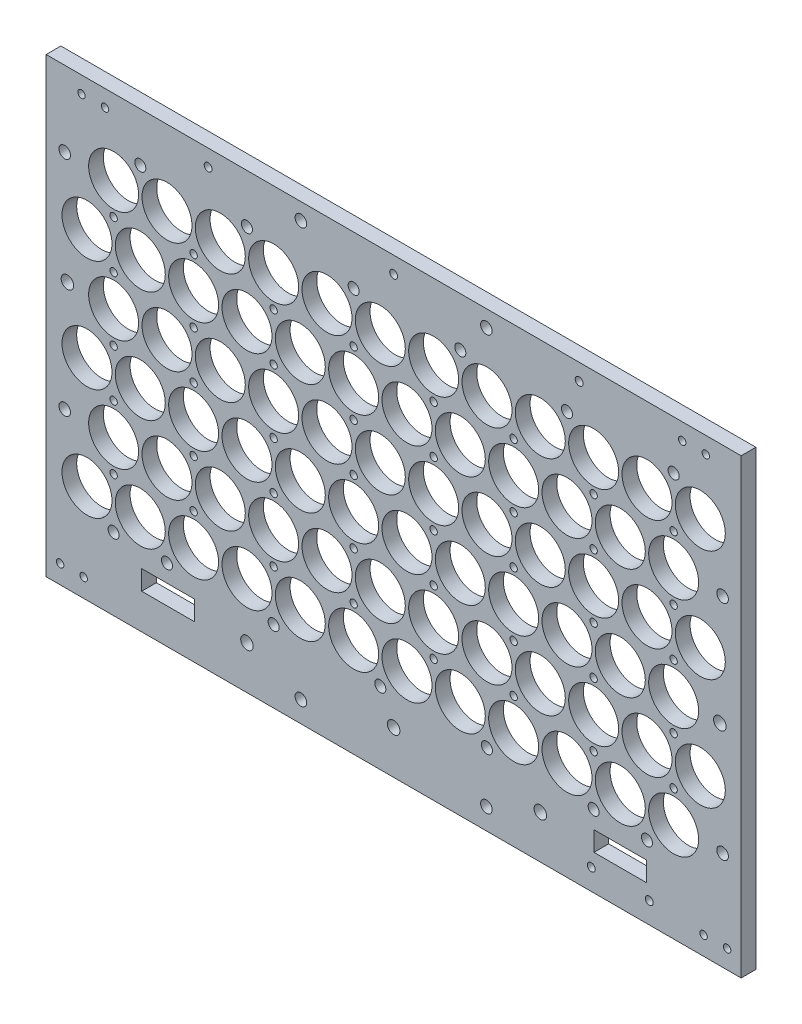
from build123d import *

# Parameters (mm, degrees)
SKETCH1_W                  = 299.700000132
SKETCH1_H                  = 194.250000104
BOSS_EXTRUDE1_DEPTH        = 6.35
SKETCH3_R                  = 10.775
CUT_EXTRUDE1_DEPTH         = 182.719853184
SKETCH4_R                  = 10.775
CUT_EXTRUDE2_DEPTH         = 182.719853184
LPATTERN1_COUNT            = 12
LPATTERN1_PITCH            = 23
LPATTERN2_COUNT            = 3
LPATTERN2_PITCH            = 48
LPATTERN2_COPY_1_SKETCH_R  = 10.775
LPATTERN2_COPY_1_DEPTH     = 182.719853184
LPATTERN2_COPY_2_SKETCH_R  = 10.775
LPATTERN2_COPY_2_DEPTH     = 182.719853184
LPATTERN2_COPY_3_SKETCH_R  = 10.775
LPATTERN2_COPY_3_DEPTH     = 182.719853184
LPATTERN2_COPY_4_SKETCH_R  = 10.775
LPATTERN2_COPY_4_DEPTH     = 182.719853184
LPATTERN2_COPY_5_SKETCH_R  = 10.775
LPATTERN2_COPY_5_DEPTH     = 182.719853184
LPATTERN2_COPY_6_SKETCH_R  = 10.775
LPATTERN2_COPY_6_DEPTH     = 182.719853184
LPATTERN2_COPY_7_SKETCH_R  = 10.775
LPATTERN2_COPY_7_DEPTH     = 182.719853184
LPATTERN2_COPY_8_SKETCH_R  = 10.775
LPATTERN2_COPY_8_DEPTH     = 182.719853184
LPATTERN2_COPY_9_SKETCH_R  = 10.775
LPATTERN2_COPY_9_DEPTH     = 182.719853184
LPATTERN2_COPY_10_SKETCH_R = 10.775
LPATTERN2_COPY_10_DEPTH    = 182.719853184
LPATTERN2_COPY_11_SKETCH_R = 10.775
LPATTERN2_COPY_11_DEPTH    = 182.719853184
LPATTERN2_COPY_12_SKETCH_R = 10.775
LPATTERN2_COPY_12_DEPTH    = 182.719853184
LPATTERN2_COPY_13_SKETCH_R = 10.775
LPATTERN2_COPY_13_DEPTH    = 182.719853184
LPATTERN2_COPY_14_SKETCH_R = 10.775
LPATTERN2_COPY_14_DEPTH    = 182.719853184
LPATTERN2_COPY_15_SKETCH_R = 10.775
LPATTERN2_COPY_15_DEPTH    = 182.719853184
LPATTERN2_COPY_16_SKETCH_R = 10.775
LPATTERN2_COPY_16_DEPTH    = 182.719853184
LPATTERN2_COPY_17_SKETCH_R = 10.775
LPATTERN2_COPY_17_DEPTH    = 182.719853184
LPATTERN2_COPY_18_SKETCH_R = 10.775
LPATTERN2_COPY_18_DEPTH    = 182.719853184
LPATTERN2_COPY_19_SKETCH_R = 10.775
LPATTERN2_COPY_19_DEPTH    = 182.719853184
LPATTERN2_COPY_20_SKETCH_R = 10.775
LPATTERN2_COPY_20_DEPTH    = 182.719853184
LPATTERN2_COPY_21_SKETCH_R = 10.775
LPATTERN2_COPY_21_DEPTH    = 182.719853184
LPATTERN2_COPY_22_SKETCH_R = 10.775
LPATTERN2_COPY_22_DEPTH    = 182.719853184
LPATTERN2_COPY_23_SKETCH_R = 10.775
LPATTERN2_COPY_23_DEPTH    = 182.719853184
LPATTERN2_COPY_24_SKETCH_R = 10.775
LPATTERN2_COPY_24_DEPTH    = 182.719853184
LPATTERN2_COPY_25_SKETCH_R = 10.775
LPATTERN2_COPY_25_DEPTH    = 182.719853184
LPATTERN2_COPY_26_SKETCH_R = 10.775
LPATTERN2_COPY_26_DEPTH    = 182.719853184
LPATTERN2_COPY_27_SKETCH_R = 10.775
LPATTERN2_COPY_27_DEPTH    = 182.719853184
LPATTERN2_COPY_28_SKETCH_R = 10.775
LPATTERN2_COPY_28_DEPTH    = 182.719853184
LPATTERN2_COPY_29_SKETCH_R = 10.775
LPATTERN2_COPY_29_DEPTH    = 182.719853184
LPATTERN2_COPY_30_SKETCH_R = 10.775
LPATTERN2_COPY_30_DEPTH    = 182.719853184
LPATTERN2_COPY_31_SKETCH_R = 10.775
LPATTERN2_COPY_31_DEPTH    = 182.719853184
LPATTERN2_COPY_32_SKETCH_R = 10.775
LPATTERN2_COPY_32_DEPTH    = 182.719853184
LPATTERN2_COPY_33_SKETCH_R = 10.775
LPATTERN2_COPY_33_DEPTH    = 182.719853184
LPATTERN2_COPY_34_SKETCH_R = 10.775
LPATTERN2_COPY_34_DEPTH    = 182.719853184
LPATTERN2_COPY_35_SKETCH_R = 10.775
LPATTERN2_COPY_35_DEPTH    = 182.719853184
LPATTERN2_COPY_36_SKETCH_R = 10.775
LPATTERN2_COPY_36_DEPTH    = 182.719853184
LPATTERN2_COPY_37_SKETCH_R = 10.775
LPATTERN2_COPY_37_DEPTH    = 182.719853184
LPATTERN2_COPY_38_SKETCH_R = 10.775
LPATTERN2_COPY_38_DEPTH    = 182.719853184
LPATTERN2_COPY_39_SKETCH_R = 10.775
LPATTERN2_COPY_39_DEPTH    = 182.719853184
LPATTERN2_COPY_40_SKETCH_R = 10.775
LPATTERN2_COPY_40_DEPTH    = 182.719853184
LPATTERN2_COPY_41_SKETCH_R = 10.775
LPATTERN2_COPY_41_DEPTH    = 182.719853184
LPATTERN2_COPY_42_SKETCH_R = 10.775
LPATTERN2_COPY_42_DEPTH    = 182.719853184
LPATTERN2_COPY_43_SKETCH_R = 10.775
LPATTERN2_COPY_43_DEPTH    = 182.719853184
LPATTERN2_COPY_44_SKETCH_R = 10.775
LPATTERN2_COPY_44_DEPTH    = 182.719853184
SKETCH5_W                  = 22.76
SKETCH5_H                  = 8.4615
CUT_EXTRUDE3_DEPTH         = 182.719853184
M3_CLEARANCE_HOLE1_D       = 3.2
M3_CLEARANCE_HOLE2_D       = 3.4
SKETCH14_R                 = 2.7
CUT_EXTRUDE4_DEPTH         = 182.719853184
SKETCH15_R                 = 2.5
CUT_EXTRUDE5_DEPTH         = 182.719853184
SKETCH16_R                 = 1.5875
CUT_EXTRUDE6_DEPTH         = 182.719853184
LPATTERN3_COUNT            = 4
LPATTERN3_PITCH            = 69
SKETCH18_R                 = 2.38125
CUT_EXTRUDE7_DEPTH         = 182.719853184
SKETCH19_W                 = 299.700000132
SKETCH19_H                 = 6.35
BOSS_EXTRUDE2_DEPTH        = 0.79375


with BuildPart() as part:
    # Sketch1 → Boss-Extrude1 (new body)
    with BuildSketch(Plane.XY):
        with Locations((0, -5.475000052)):
            Rectangle(SKETCH1_W, SKETCH1_H)
    extrude(amount=BOSS_EXTRUDE1_DEPTH)

    # Sketch3 → Cut-Extrude1 (cut, through all)
    with BuildSketch(Plane.XY.offset(6.35)):
        with Locations((-132.25, -60)):
            Circle(SKETCH3_R)
    cut_extrude1 = extrude(amount=-CUT_EXTRUDE1_DEPTH, mode=Mode.SUBTRACT)

    # Sketch4 → Cut-Extrude2 (cut, through all)
    with BuildSketch(Plane.XY.offset(6.35)):
        with Locations((-120.75, -36)):
            Circle(SKETCH4_R)
    cut_extrude2 = extrude(amount=-CUT_EXTRUDE2_DEPTH, mode=Mode.SUBTRACT)

    # LPattern1: Cut-Extrude1, Cut-Extrude2 ×12
    with Locations(*[(i * LPATTERN1_PITCH, 0, 0) for i in range(1, LPATTERN1_COUNT)]):
        add(cut_extrude1, mode=Mode.SUBTRACT)
        add(cut_extrude2, mode=Mode.SUBTRACT)

    # LPattern2: Cut-Extrude1, Cut-Extrude2 ×3
    with Locations(*[(0, i * LPATTERN2_PITCH, 0) for i in range(1, LPATTERN2_COUNT)]):
        add(cut_extrude1, mode=Mode.SUBTRACT)
        add(cut_extrude2, mode=Mode.SUBTRACT)

    # LPattern2 copy 1 sketch → LPattern2 copy 1 (cut, through all)
    with BuildSketch(Plane(origin=(23, 48, 6.35), x_dir=(1, 0, 0), z_dir=(0, 0, 1))):
        with Locations((-132.25, -60)):
            Circle(LPATTERN2_COPY_1_SKETCH_R)
    extrude(amount=-LPATTERN2_COPY_1_DEPTH, mode=Mode.SUBTRACT)

    # LPattern2 copy 2 sketch → LPattern2 copy 2 (cut, through all)
    with BuildSketch(Plane(origin=(23, 96, 6.35), x_dir=(1, 0, 0), z_dir=(0, 0, 1))):
        with Locations((-132.25, -60)):
            Circle(LPATTERN2_COPY_2_SKETCH_R)
    extrude(amount=-LPATTERN2_COPY_2_DEPTH, mode=Mode.SUBTRACT)

    # LPattern2 copy 3 sketch → LPattern2 copy 3 (cut, through all)
    with BuildSketch(Plane(origin=(46, 48, 6.35), x_dir=(1, 0, 0), z_dir=(0, 0, 1))):
        with Locations((-132.25, -60)):
            Circle(LPATTERN2_COPY_3_SKETCH_R)
    extrude(amount=-LPATTERN2_COPY_3_DEPTH, mode=Mode.SUBTRACT)

    # LPattern2 copy 4 sketch → LPattern2 copy 4 (cut, through all)
    with BuildSketch(Plane(origin=(46, 96, 6.35), x_dir=(1, 0, 0), z_dir=(0, 0, 1))):
        with Locations((-132.25, -60)):
            Circle(LPATTERN2_COPY_4_SKETCH_R)
    extrude(amount=-LPATTERN2_COPY_4_DEPTH, mode=Mode.SUBTRACT)

    # LPattern2 copy 5 sketch → LPattern2 copy 5 (cut, through all)
    with BuildSketch(Plane(origin=(69, 48, 6.35), x_dir=(1, 0, 0), z_dir=(0, 0, 1))):
        with Locations((-132.25, -60)):
            Circle(LPATTERN2_COPY_5_SKETCH_R)
    extrude(amount=-LPATTERN2_COPY_5_DEPTH, mode=Mode.SUBTRACT)

    # LPattern2 copy 6 sketch → LPattern2 copy 6 (cut, through all)
    with BuildSketch(Plane(origin=(69, 96, 6.35), x_dir=(1, 0, 0), z_dir=(0, 0, 1))):
        with Locations((-132.25, -60)):
            Circle(LPATTERN2_COPY_6_SKETCH_R)
    extrude(amount=-LPATTERN2_COPY_6_DEPTH, mode=Mode.SUBTRACT)

    # LPattern2 copy 7 sketch → LPattern2 copy 7 (cut, through all)
    with BuildSketch(Plane(origin=(92, 48, 6.35), x_dir=(1, 0, 0), z_dir=(0, 0, 1))):
        with Locations((-132.25, -60)):
            Circle(LPATTERN2_COPY_7_SKETCH_R)
    extrude(amount=-LPATTERN2_COPY_7_DEPTH, mode=Mode.SUBTRACT)

    # LPattern2 copy 8 sketch → LPattern2 copy 8 (cut, through all)
    with BuildSketch(Plane(origin=(92, 96, 6.35), x_dir=(1, 0, 0), z_dir=(0, 0, 1))):
        with Locations((-132.25, -60)):
            Circle(LPATTERN2_COPY_8_SKETCH_R)
    extrude(amount=-LPATTERN2_COPY_8_DEPTH, mode=Mode.SUBTRACT)

    # LPattern2 copy 9 sketch → LPattern2 copy 9 (cut, through all)
    with BuildSketch(Plane(origin=(115, 48, 6.35), x_dir=(1, 0, 0), z_dir=(0, 0, 1))):
        with Locations((-132.25, -60)):
            Circle(LPATTERN2_COPY_9_SKETCH_R)
    extrude(amount=-LPATTERN2_COPY_9_DEPTH, mode=Mode.SUBTRACT)

    # LPattern2 copy 10 sketch → LPattern2 copy 10 (cut, through all)
    with BuildSketch(Plane(origin=(115, 96, 6.35), x_dir=(1, 0, 0), z_dir=(0, 0, 1))):
        with Locations((-132.25, -60)):
            Circle(LPATTERN2_COPY_10_SKETCH_R)
    extrude(amount=-LPATTERN2_COPY_10_DEPTH, mode=Mode.SUBTRACT)

    # LPattern2 copy 11 sketch → LPattern2 copy 11 (cut, through all)
    with BuildSketch(Plane(origin=(138, 48, 6.35), x_dir=(1, 0, 0), z_dir=(0, 0, 1))):
        with Locations((-132.25, -60)):
            Circle(LPATTERN2_COPY_11_SKETCH_R)
    extrude(amount=-LPATTERN2_COPY_11_DEPTH, mode=Mode.SUBTRACT)

    # LPattern2 copy 12 sketch → LPattern2 copy 12 (cut, through all)
    with BuildSketch(Plane(origin=(138, 96, 6.35), x_dir=(1, 0, 0), z_dir=(0, 0, 1))):
        with Locations((-132.25, -60)):
            Circle(LPATTERN2_COPY_12_SKETCH_R)
    extrude(amount=-LPATTERN2_COPY_12_DEPTH, mode=Mode.SUBTRACT)

    # LPattern2 copy 13 sketch → LPattern2 copy 13 (cut, through all)
    with BuildSketch(Plane(origin=(161, 48, 6.35), x_dir=(1, 0, 0), z_dir=(0, 0, 1))):
        with Locations((-132.25, -60)):
            Circle(LPATTERN2_COPY_13_SKETCH_R)
    extrude(amount=-LPATTERN2_COPY_13_DEPTH, mode=Mode.SUBTRACT)

    # LPattern2 copy 14 sketch → LPattern2 copy 14 (cut, through all)
    with BuildSketch(Plane(origin=(161, 96, 6.35), x_dir=(1, 0, 0), z_dir=(0, 0, 1))):
        with Locations((-132.25, -60)):
            Circle(LPATTERN2_COPY_14_SKETCH_R)
    extrude(amount=-LPATTERN2_COPY_14_DEPTH, mode=Mode.SUBTRACT)

    # LPattern2 copy 15 sketch → LPattern2 copy 15 (cut, through all)
    with BuildSketch(Plane(origin=(184, 48, 6.35), x_dir=(1, 0, 0), z_dir=(0, 0, 1))):
        with Locations((-132.25, -60)):
            Circle(LPATTERN2_COPY_15_SKETCH_R)
    extrude(amount=-LPATTERN2_COPY_15_DEPTH, mode=Mode.SUBTRACT)

    # LPattern2 copy 16 sketch → LPattern2 copy 16 (cut, through all)
    with BuildSketch(Plane(origin=(184, 96, 6.35), x_dir=(1, 0, 0), z_dir=(0, 0, 1))):
        with Locations((-132.25, -60)):
            Circle(LPATTERN2_COPY_16_SKETCH_R)
    extrude(amount=-LPATTERN2_COPY_16_DEPTH, mode=Mode.SUBTRACT)

    # LPattern2 copy 17 sketch → LPattern2 copy 17 (cut, through all)
    with BuildSketch(Plane(origin=(207, 48, 6.35), x_dir=(1, 0, 0), z_dir=(0, 0, 1))):
        with Locations((-132.25, -60)):
            Circle(LPATTERN2_COPY_17_SKETCH_R)
    extrude(amount=-LPATTERN2_COPY_17_DEPTH, mode=Mode.SUBTRACT)

    # LPattern2 copy 18 sketch → LPattern2 copy 18 (cut, through all)
    with BuildSketch(Plane(origin=(207, 96, 6.35), x_dir=(1, 0, 0), z_dir=(0, 0, 1))):
        with Locations((-132.25, -60)):
            Circle(LPATTERN2_COPY_18_SKETCH_R)
    extrude(amount=-LPATTERN2_COPY_18_DEPTH, mode=Mode.SUBTRACT)

    # LPattern2 copy 19 sketch → LPattern2 copy 19 (cut, through all)
    with BuildSketch(Plane(origin=(230, 48, 6.35), x_dir=(1, 0, 0), z_dir=(0, 0, 1))):
        with Locations((-132.25, -60)):
            Circle(LPATTERN2_COPY_19_SKETCH_R)
    extrude(amount=-LPATTERN2_COPY_19_DEPTH, mode=Mode.SUBTRACT)

    # LPattern2 copy 20 sketch → LPattern2 copy 20 (cut, through all)
    with BuildSketch(Plane(origin=(230, 96, 6.35), x_dir=(1, 0, 0), z_dir=(0, 0, 1))):
        with Locations((-132.25, -60)):
            Circle(LPATTERN2_COPY_20_SKETCH_R)
    extrude(amount=-LPATTERN2_COPY_20_DEPTH, mode=Mode.SUBTRACT)

    # LPattern2 copy 21 sketch → LPattern2 copy 21 (cut, through all)
    with BuildSketch(Plane(origin=(253, 48, 6.35), x_dir=(1, 0, 0), z_dir=(0, 0, 1))):
        with Locations((-132.25, -60)):
            Circle(LPATTERN2_COPY_21_SKETCH_R)
    extrude(amount=-LPATTERN2_COPY_21_DEPTH, mode=Mode.SUBTRACT)

    # LPattern2 copy 22 sketch → LPattern2 copy 22 (cut, through all)
    with BuildSketch(Plane(origin=(253, 96, 6.35), x_dir=(1, 0, 0), z_dir=(0, 0, 1))):
        with Locations((-132.25, -60)):
            Circle(LPATTERN2_COPY_22_SKETCH_R)
    extrude(amount=-LPATTERN2_COPY_22_DEPTH, mode=Mode.SUBTRACT)

    # LPattern2 copy 23 sketch → LPattern2 copy 23 (cut, through all)
    with BuildSketch(Plane(origin=(23, 48, 6.35), x_dir=(1, 0, 0), z_dir=(0, 0, 1))):
        with Locations((-120.75, -36)):
            Circle(LPATTERN2_COPY_23_SKETCH_R)
    extrude(amount=-LPATTERN2_COPY_23_DEPTH, mode=Mode.SUBTRACT)

    # LPattern2 copy 24 sketch → LPattern2 copy 24 (cut, through all)
    with BuildSketch(Plane(origin=(23, 96, 6.35), x_dir=(1, 0, 0), z_dir=(0, 0, 1))):
        with Locations((-120.75, -36)):
            Circle(LPATTERN2_COPY_24_SKETCH_R)
    extrude(amount=-LPATTERN2_COPY_24_DEPTH, mode=Mode.SUBTRACT)

    # LPattern2 copy 25 sketch → LPattern2 copy 25 (cut, through all)
    with BuildSketch(Plane(origin=(46, 48, 6.35), x_dir=(1, 0, 0), z_dir=(0, 0, 1))):
        with Locations((-120.75, -36)):
            Circle(LPATTERN2_COPY_25_SKETCH_R)
    extrude(amount=-LPATTERN2_COPY_25_DEPTH, mode=Mode.SUBTRACT)

    # LPattern2 copy 26 sketch → LPattern2 copy 26 (cut, through all)
    with BuildSketch(Plane(origin=(46, 96, 6.35), x_dir=(1, 0, 0), z_dir=(0, 0, 1))):
        with Locations((-120.75, -36)):
            Circle(LPATTERN2_COPY_26_SKETCH_R)
    extrude(amount=-LPATTERN2_COPY_26_DEPTH, mode=Mode.SUBTRACT)

    # LPattern2 copy 27 sketch → LPattern2 copy 27 (cut, through all)
    with BuildSketch(Plane(origin=(69, 48, 6.35), x_dir=(1, 0, 0), z_dir=(0, 0, 1))):
        with Locations((-120.75, -36)):
            Circle(LPATTERN2_COPY_27_SKETCH_R)
    extrude(amount=-LPATTERN2_COPY_27_DEPTH, mode=Mode.SUBTRACT)

    # LPattern2 copy 28 sketch → LPattern2 copy 28 (cut, through all)
    with BuildSketch(Plane(origin=(69, 96, 6.35), x_dir=(1, 0, 0), z_dir=(0, 0, 1))):
        with Locations((-120.75, -36)):
            Circle(LPATTERN2_COPY_28_SKETCH_R)
    extrude(amount=-LPATTERN2_COPY_28_DEPTH, mode=Mode.SUBTRACT)

    # LPattern2 copy 29 sketch → LPattern2 copy 29 (cut, through all)
    with BuildSketch(Plane(origin=(92, 48, 6.35), x_dir=(1, 0, 0), z_dir=(0, 0, 1))):
        with Locations((-120.75, -36)):
            Circle(LPATTERN2_COPY_29_SKETCH_R)
    extrude(amount=-LPATTERN2_COPY_29_DEPTH, mode=Mode.SUBTRACT)

    # LPattern2 copy 30 sketch → LPattern2 copy 30 (cut, through all)
    with BuildSketch(Plane(origin=(92, 96, 6.35), x_dir=(1, 0, 0), z_dir=(0, 0, 1))):
        with Locations((-120.75, -36)):
            Circle(LPATTERN2_COPY_30_SKETCH_R)
    extrude(amount=-LPATTERN2_COPY_30_DEPTH, mode=Mode.SUBTRACT)

    # LPattern2 copy 31 sketch → LPattern2 copy 31 (cut, through all)
    with BuildSketch(Plane(origin=(115, 48, 6.35), x_dir=(1, 0, 0), z_dir=(0, 0, 1))):
        with Locations((-120.75, -36)):
            Circle(LPATTERN2_COPY_31_SKETCH_R)
    extrude(amount=-LPATTERN2_COPY_31_DEPTH, mode=Mode.SUBTRACT)

    # LPattern2 copy 32 sketch → LPattern2 copy 32 (cut, through all)
    with BuildSketch(Plane(origin=(115, 96, 6.35), x_dir=(1, 0, 0), z_dir=(0, 0, 1))):
        with Locations((-120.75, -36)):
            Circle(LPATTERN2_COPY_32_SKETCH_R)
    extrude(amount=-LPATTERN2_COPY_32_DEPTH, mode=Mode.SUBTRACT)

    # LPattern2 copy 33 sketch → LPattern2 copy 33 (cut, through all)
    with BuildSketch(Plane(origin=(138, 48, 6.35), x_dir=(1, 0, 0), z_dir=(0, 0, 1))):
        with Locations((-120.75, -36)):
            Circle(LPATTERN2_COPY_33_SKETCH_R)
    extrude(amount=-LPATTERN2_COPY_33_DEPTH, mode=Mode.SUBTRACT)

    # LPattern2 copy 34 sketch → LPattern2 copy 34 (cut, through all)
    with BuildSketch(Plane(origin=(138, 96, 6.35), x_dir=(1, 0, 0), z_dir=(0, 0, 1))):
        with Locations((-120.75, -36)):
            Circle(LPATTERN2_COPY_34_SKETCH_R)
    extrude(amount=-LPATTERN2_COPY_34_DEPTH, mode=Mode.SUBTRACT)

    # LPattern2 copy 35 sketch → LPattern2 copy 35 (cut, through all)
    with BuildSketch(Plane(origin=(161, 48, 6.35), x_dir=(1, 0, 0), z_dir=(0, 0, 1))):
        with Locations((-120.75, -36)):
            Circle(LPATTERN2_COPY_35_SKETCH_R)
    extrude(amount=-LPATTERN2_COPY_35_DEPTH, mode=Mode.SUBTRACT)

    # LPattern2 copy 36 sketch → LPattern2 copy 36 (cut, through all)
    with BuildSketch(Plane(origin=(161, 96, 6.35), x_dir=(1, 0, 0), z_dir=(0, 0, 1))):
        with Locations((-120.75, -36)):
            Circle(LPATTERN2_COPY_36_SKETCH_R)
    extrude(amount=-LPATTERN2_COPY_36_DEPTH, mode=Mode.SUBTRACT)

    # LPattern2 copy 37 sketch → LPattern2 copy 37 (cut, through all)
    with BuildSketch(Plane(origin=(184, 48, 6.35), x_dir=(1, 0, 0), z_dir=(0, 0, 1))):
        with Locations((-120.75, -36)):
            Circle(LPATTERN2_COPY_37_SKETCH_R)
    extrude(amount=-LPATTERN2_COPY_37_DEPTH, mode=Mode.SUBTRACT)

    # LPattern2 copy 38 sketch → LPattern2 copy 38 (cut, through all)
    with BuildSketch(Plane(origin=(184, 96, 6.35), x_dir=(1, 0, 0), z_dir=(0, 0, 1))):
        with Locations((-120.75, -36)):
            Circle(LPATTERN2_COPY_38_SKETCH_R)
    extrude(amount=-LPATTERN2_COPY_38_DEPTH, mode=Mode.SUBTRACT)

    # LPattern2 copy 39 sketch → LPattern2 copy 39 (cut, through all)
    with BuildSketch(Plane(origin=(207, 48, 6.35), x_dir=(1, 0, 0), z_dir=(0, 0, 1))):
        with Locations((-120.75, -36)):
            Circle(LPATTERN2_COPY_39_SKETCH_R)
    extrude(amount=-LPATTERN2_COPY_39_DEPTH, mode=Mode.SUBTRACT)

    # LPattern2 copy 40 sketch → LPattern2 copy 40 (cut, through all)
    with BuildSketch(Plane(origin=(207, 96, 6.35), x_dir=(1, 0, 0), z_dir=(0, 0, 1))):
        with Locations((-120.75, -36)):
            Circle(LPATTERN2_COPY_40_SKETCH_R)
    extrude(amount=-LPATTERN2_COPY_40_DEPTH, mode=Mode.SUBTRACT)

    # LPattern2 copy 41 sketch → LPattern2 copy 41 (cut, through all)
    with BuildSketch(Plane(origin=(230, 48, 6.35), x_dir=(1, 0, 0), z_dir=(0, 0, 1))):
        with Locations((-120.75, -36)):
            Circle(LPATTERN2_COPY_41_SKETCH_R)
    extrude(amount=-LPATTERN2_COPY_41_DEPTH, mode=Mode.SUBTRACT)

    # LPattern2 copy 42 sketch → LPattern2 copy 42 (cut, through all)
    with BuildSketch(Plane(origin=(230, 96, 6.35), x_dir=(1, 0, 0), z_dir=(0, 0, 1))):
        with Locations((-120.75, -36)):
            Circle(LPATTERN2_COPY_42_SKETCH_R)
    extrude(amount=-LPATTERN2_COPY_42_DEPTH, mode=Mode.SUBTRACT)

    # LPattern2 copy 43 sketch → LPattern2 copy 43 (cut, through all)
    with BuildSketch(Plane(origin=(253, 48, 6.35), x_dir=(1, 0, 0), z_dir=(0, 0, 1))):
        with Locations((-120.75, -36)):
            Circle(LPATTERN2_COPY_43_SKETCH_R)
    extrude(amount=-LPATTERN2_COPY_43_DEPTH, mode=Mode.SUBTRACT)

    # LPattern2 copy 44 sketch → LPattern2 copy 44 (cut, through all)
    with BuildSketch(Plane(origin=(253, 96, 6.35), x_dir=(1, 0, 0), z_dir=(0, 0, 1))):
        with Locations((-120.75, -36)):
            Circle(LPATTERN2_COPY_44_SKETCH_R)
    extrude(amount=-LPATTERN2_COPY_44_DEPTH, mode=Mode.SUBTRACT)

    # Sketch5 → Cut-Extrude3 (cut, through all)
    # profile 1 of 4: a face of its own
    with BuildSketch(Plane.XY.offset(6.35)):
        with Locations((97.75, -83.18075)):
            Rectangle(SKETCH5_W, SKETCH5_H)
        with BuildLine():
            Line((90.18464302, -79.3475), (105.31535698, -79.3475))
            ThreePointArc((105.31535698, -79.3475), (105.176769839, -79.814816153), (105.13, -80.3))
            Line((105.13, -80.3), (105.13, -83.4115))
            Line((105.13, -83.4115), (90.37, -83.4115))
            Line((90.37, -83.4115), (90.37, -80.3))
            ThreePointArc((90.37, -80.3), (90.323230161, -79.814816153), (90.18464302, -79.3475))
        make_face(mode=Mode.SUBTRACT)
    # profile 2 of 4: a face of its own
    with BuildSketch(Plane.XY.offset(6.35)):
        with BuildLine():
            ThreePointArc((105.31535698, -79.3475), (105.176769839, -79.814816153), (105.13, -80.3))
            Line((105.13, -80.3), (105.13, -83.4115))
            Line((105.13, -83.4115), (90.37, -83.4115))
            Line((90.37, -83.4115), (90.37, -80.3))
            ThreePointArc((90.37, -80.3), (90.323230161, -79.814816153), (90.18464302, -79.3475))
            Line((90.18464302, -79.3475), (105.31535698, -79.3475))
        make_face()
    # profile 3 of 4: a face of its own
    with BuildSketch(Plane.XY.offset(6.35)):
        with Locations((-97.288, -83.18075)):
            Rectangle(SKETCH5_W, SKETCH5_H)
        with BuildLine():
            Line((-104.85335698, -79.3475), (-89.72264302, -79.3475))
            ThreePointArc((-89.72264302, -79.3475), (-89.861230161, -79.814816153), (-89.908, -80.3))
            Line((-89.908, -80.3), (-89.908, -83.4115))
            Line((-89.908, -83.4115), (-104.668, -83.4115))
            Line((-104.668, -83.4115), (-104.668, -80.3))
            ThreePointArc((-104.668, -80.3), (-104.714769839, -79.814816153), (-104.85335698, -79.3475))
        make_face(mode=Mode.SUBTRACT)
    # profile 4 of 4: a face of its own
    with BuildSketch(Plane.XY.offset(6.35)):
        with BuildLine():
            ThreePointArc((-89.72264302, -79.3475), (-89.861230161, -79.814816153), (-89.908, -80.3))
            Line((-89.908, -80.3), (-89.908, -83.4115))
            Line((-89.908, -83.4115), (-104.668, -83.4115))
            Line((-104.668, -83.4115), (-104.668, -80.3))
            ThreePointArc((-104.668, -80.3), (-104.714769839, -79.814816153), (-104.85335698, -79.3475))
            Line((-104.85335698, -79.3475), (-89.72264302, -79.3475))
        make_face()
    extrude(amount=-CUT_EXTRUDE3_DEPTH, mode=Mode.SUBTRACT)

    # M3 Clearance Hole1 (through all)
    with Locations(Plane.XY.offset(6.35)):
        with Locations((124.450000066, 85.3), (134.610000066, 85.3), (-124.450000066, 85.3), (-134.610000066, 85.3), (-143.817500066, -94.6000001), (-133.657500066, -94.6000001), (133.657500066, -94.6000001), (143.817500066, -94.6000001)):
            Hole(M3_CLEARANCE_HOLE1_D / 2)

    # M3 Clearance Hole2 (through all)
    with Locations(Plane.XY.offset(6.35)):
        with Locations((110.25, -93.50575), (85.25, -93.50575), (-80, 85.3), (0, 85.3), (80, 85.3)):
            Hole(M3_CLEARANCE_HOLE2_D / 2)

    # Sketch14 → Cut-Extrude4 (cut, through all)
    with BuildSketch(Plane.XY.offset(6.35)):
        with Locations((140.687500033, -12)):
            Circle(SKETCH14_R)
        with Locations((-140.687500033, 12)):
            Circle(SKETCH14_R)
        with Locations((63.25, -83.95)):
            Circle(SKETCH14_R)
        with Locations(Location((-63.25, -83.95, 0), (0, 0, 180))):
            Circle(SKETCH14_R)
        with Locations((0, -83.95)):
            Circle(SKETCH14_R)
    extrude(amount=-CUT_EXTRUDE4_DEPTH, mode=Mode.SUBTRACT)

    # Sketch15 → Cut-Extrude5 (cut, through all)
    with BuildSketch(Plane.XY.offset(6.35)):
        with Locations((-40, 85.3)):
            Circle(SKETCH15_R)
        with Locations((40, 85.3)):
            Circle(SKETCH15_R)
        with Locations((141.850000066, 36)):
            Circle(SKETCH15_R)
        with Locations((141.850000066, -60)):
            Circle(SKETCH15_R)
        with Locations((-141.850000066, -36)):
            Circle(SKETCH15_R)
        with Locations((-141.850000066, 60)):
            Circle(SKETCH15_R)
        with Locations((-40, -93.50575)):
            Circle(SKETCH15_R)
        with Locations((40, -93.50575)):
            Circle(SKETCH15_R)
    extrude(amount=-CUT_EXTRUDE5_DEPTH, mode=Mode.SUBTRACT)

    # Sketch16 → Cut-Extrude6 (cut, through all)
    with BuildSketch(Plane.XY.offset(6.35)):
        with Locations((86.25, -49.71)):
            Circle(SKETCH16_R)
        with Locations((120.75, -46.29)):
            Circle(SKETCH16_R)
        with Locations((120.75, -25.71)):
            Circle(SKETCH16_R)
        with Locations((86.25, -22.29)):
            Circle(SKETCH16_R)
        with Locations((120.75, 1.71)):
            Circle(SKETCH16_R)
        with Locations((86.25, -1.71)):
            Circle(SKETCH16_R)
        with Locations((120.75, 22.29)):
            Circle(SKETCH16_R)
        with Locations((86.25, 25.71)):
            Circle(SKETCH16_R)
        with Locations((120.75, 49.71)):
            Circle(SKETCH16_R)
        with Locations((86.25, 46.29)):
            Circle(SKETCH16_R)
    cut_extrude6 = extrude(amount=-CUT_EXTRUDE6_DEPTH, mode=Mode.SUBTRACT)

    # LPattern3: Cut-Extrude6 ×4
    with Locations(*[(-i * LPATTERN3_PITCH, 0, 0) for i in range(1, LPATTERN3_COUNT)]):
        add(cut_extrude6, mode=Mode.SUBTRACT)

    # Sketch18 → Cut-Extrude7 (cut, through all)
    with BuildSketch(Plane.XY.offset(6.35)):
        with Locations((109.25, -71.41)):
            Circle(SKETCH18_R)
        with Locations((86.25, -71.41)):
            Circle(SKETCH18_R)
        with Locations((120.75, 71.41)):
            Circle(SKETCH18_R)
        with Locations((74.75, 71.41)):
            Circle(SKETCH18_R)
        with Locations((28.75, 71.41)):
            Circle(SKETCH18_R)
        with Locations((-17.25, 71.41)):
            Circle(SKETCH18_R)
        with Locations((-63.25, 71.41)):
            Circle(SKETCH18_R)
        with Locations((-109.25, 71.41)):
            Circle(SKETCH18_R)
        with Locations((40.25, -71.41)):
            Circle(SKETCH18_R)
        with Locations((-5.75, -71.41)):
            Circle(SKETCH18_R)
        with Locations((-51.75, -71.41)):
            Circle(SKETCH18_R)
        with Locations((-97.75, -71.41)):
            Circle(SKETCH18_R)
        with Locations((-120.75, -71.41)):
            Circle(SKETCH18_R)
    extrude(amount=-CUT_EXTRUDE7_DEPTH, mode=Mode.SUBTRACT)

    # Sketch19 → Boss-Extrude2 (add)
    with BuildSketch(Plane(origin=(0, 91.65, 0), x_dir=(1, 0, 0), z_dir=(0, 1, 0))):
        with Locations((0, -3.175)):
            Rectangle(SKETCH19_W, SKETCH19_H)
    extrude(amount=BOSS_EXTRUDE2_DEPTH)


solid = part.part
